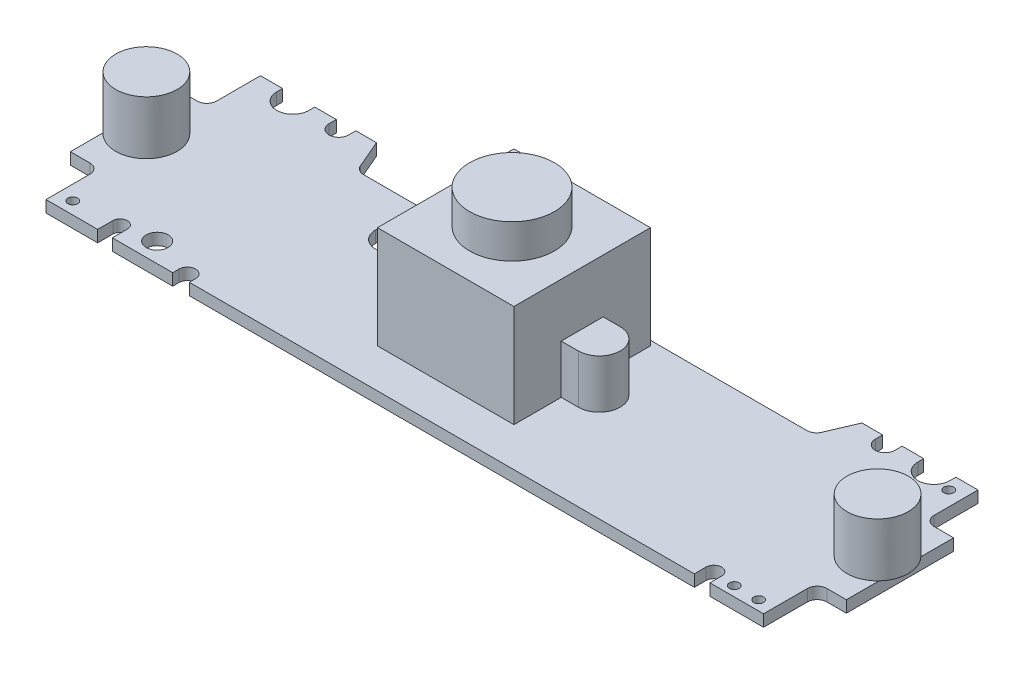
from build123d import *

# Parameters (mm, degrees)
SKETCH1_R                = 0.5
SKETCH1_R_2              = 1.125
PCB_DEPTH                = 1.2
SKETCH2_R                = 3.15
SPEAKERS_DEPTH           = 5.5
SKETCH3_W                = 14
SKETCH3_H                = 14
LENS_MOUNT_DEPTH         = 10.5
LENS_MOUTING_HOLES_DEPTH = 5
SKETCH5_R                = 4.35
LENS_DEPTH               = 3.5


with BuildPart() as part:
    # Sketch1 → PCB (new body)
    with BuildSketch(Plane(origin=(0, 0, 0), x_dir=(1, 0, 0), z_dir=(0, 1, 0))):
        with BuildLine():
            Line((-36.8, -11), (-31.5, -11))
            Line((-31.5, -11), (-31.5, -9.45))
            ThreePointArc((-31.5, -9.45), (-30.75, -8.7), (-30, -9.45))
            Line((-30, -9.45), (-30, -11))
            Line((-30, -11), (-23.8, -11))
            Line((-23.8, -11), (-23.8, -10.35))
            ThreePointArc((-23.8, -10.35), (-22.95, -9.5), (-22.1, -10.35))
            Line((-22.1, -10.35), (-22.1, -11))
            Line((-22.1, -11), (29.7, -11))
            Line((29.7, -11), (29.7, -9.8))
            ThreePointArc((29.7, -9.8), (30.5, -9), (31.3, -9.8))
            Line((31.3, -9.8), (31.3, -11))
            Line((31.3, -11), (36.8, -11))
            Line((36.8, -11), (36.8, -6.5))
            ThreePointArc((36.8, -6.5), (37.092893219, -5.792893219), (37.8, -5.5))
            Line((37.8, -5.5), (39.8, -5.5))
            Line((39.8, -5.5), (39.8, 5.5))
            Line((39.8, 5.5), (37.8, 5.5))
            ThreePointArc((37.8, 5.5), (37.092893219, 5.792893219), (36.8, 6.5))
            Line((36.8, 6.5), (36.8, 11))
            Line((36.8, 11), (34.531625915, 11))
            Line((34.531625915, 11), (34.531625915, 10.4))
            ThreePointArc((34.531625915, 10.4), (32.881625915, 8.75), (31.231625915, 10.4))
            Line((31.231625915, 10.4), (31.231625915, 11))
            Line((31.231625915, 11), (29.016759255, 11))
            Line((29.016759255, 11), (29.016759255, 10.25))
            ThreePointArc((29.016759255, 10.25), (28.016759255, 9.25), (27.016759255, 10.25))
            Line((27.016759255, 10.25), (27.016759255, 11))
            Line((27.016759255, 11), (24.9, 11))
            Line((24.9, 11), (23.659748872, 8.106080701))
            ThreePointArc((23.659748872, 8.106080701), (23.291094851, 7.665158908), (22.740603842, 7.5))
            Line((22.740603842, 7.5), (-13.8, 7.5))
            Line((-13.8, 7.5), (-13.8, 3.194222302))
            ThreePointArc((-13.8, 3.194222302), (-15.5, 1.494222302), (-17.2, 3.194222302))
            Line((-17.2, 3.194222302), (-17.2, 7.5))
            Line((-17.2, 7.5), (-22.740603842, 7.5))
            ThreePointArc((-22.740603842, 7.5), (-23.291094851, 7.665158908), (-23.659748872, 8.106080701))
            Line((-23.659748872, 8.106080701), (-24.9, 11))
            Line((-24.9, 11), (-27.016759255, 11))
            Line((-27.016759255, 11), (-27.016759255, 10.25))
            ThreePointArc((-27.016759255, 10.25), (-28.016759255, 9.25), (-29.016759255, 10.25))
            Line((-29.016759255, 10.25), (-29.016759255, 11))
            Line((-29.016759255, 11), (-31.231625915, 11))
            Line((-31.231625915, 11), (-31.231625915, 10.4))
            ThreePointArc((-31.231625915, 10.4), (-32.881625915, 8.75), (-34.531625915, 10.4))
            Line((-34.531625915, 10.4), (-34.531625915, 11))
            Line((-34.531625915, 11), (-36.8, 11))
            Line((-36.8, 11), (-36.8, 6.5))
            ThreePointArc((-36.8, 6.5), (-37.092893219, 5.792893219), (-37.8, 5.5))
            Line((-37.8, 5.5), (-39.8, 5.5))
            Line((-39.8, 5.5), (-39.8, -5.5))
            Line((-39.8, -5.5), (-37.8, -5.5))
            ThreePointArc((-37.8, -5.5), (-37.092893219, -5.792893219), (-36.8, -6.5))
            Line((-36.8, -6.5), (-36.8, -11))
        make_face()
        with Locations(Location((35.3, 9.5, 0), (0, 0, 270))):
            Circle(SKETCH1_R, mode=Mode.SUBTRACT)
        with Locations(Location((-35.3, -9.75, 0), (0, 0, 270))):
            Circle(SKETCH1_R, mode=Mode.SUBTRACT)
        with Locations(Location((-27.4, -9, 0), (0, 0, 270))):
            Circle(SKETCH1_R_2, mode=Mode.SUBTRACT)
        with Locations(Location((35.3, -10, 0), (0, 0, 270))):
            Circle(SKETCH1_R, mode=Mode.SUBTRACT)
        with Locations(Location((32.8, -10, 0), (0, 0, 270))):
            Circle(SKETCH1_R, mode=Mode.SUBTRACT)
    extrude(amount=PCB_DEPTH)

    # Sketch2 → speakers (add)
    with BuildSketch(Plane(origin=(0, 1.2, 0), x_dir=(1, 0, 0), z_dir=(0, 1, 0))):
        with Locations(Location((-37.5, 0, 0), (0, 0, 136.899702613))):
            Circle(SKETCH2_R)
        with Locations(Location((37.5, 0, 0), (0, 0, 43.100297387))):
            Circle(SKETCH2_R)
    extrude(amount=SPEAKERS_DEPTH)

    # Sketch3 → lens_mount (add)
    with BuildSketch(Plane(origin=(0, 1.2, 0), x_dir=(1, 0, 0), z_dir=(0, 1, 0))):
        with Locations((0.2, 0)):
            Rectangle(SKETCH3_W, SKETCH3_H)
    extrude(amount=LENS_MOUNT_DEPTH)

    # Sketch4 → lens_mouting_holes (add)
    with BuildSketch(Plane(origin=(0, 1.2, 0), x_dir=(1, 0, 0), z_dir=(0, 1, 0))):
        with BuildLine():
            Line((-8.55, 2.15), (8.95, 2.15))
            ThreePointArc((8.95, 2.15), (11.1, 0), (8.95, -2.15))
            Line((8.95, -2.15), (-8.55, -2.15))
            ThreePointArc((-8.55, -2.15), (-10.7, 0), (-8.55, 2.15))
        make_face()
    extrude(amount=LENS_MOUTING_HOLES_DEPTH)

    # Sketch5 → lens (add)
    with BuildSketch(Plane(origin=(0, 11.7, 0), x_dir=(1, 0, 0), z_dir=(0, 1, 0))):
        with Locations(Location((0, 0, 0), (0, 0, 90))):
            Circle(SKETCH5_R)
    extrude(amount=LENS_DEPTH)


solid = part.part
